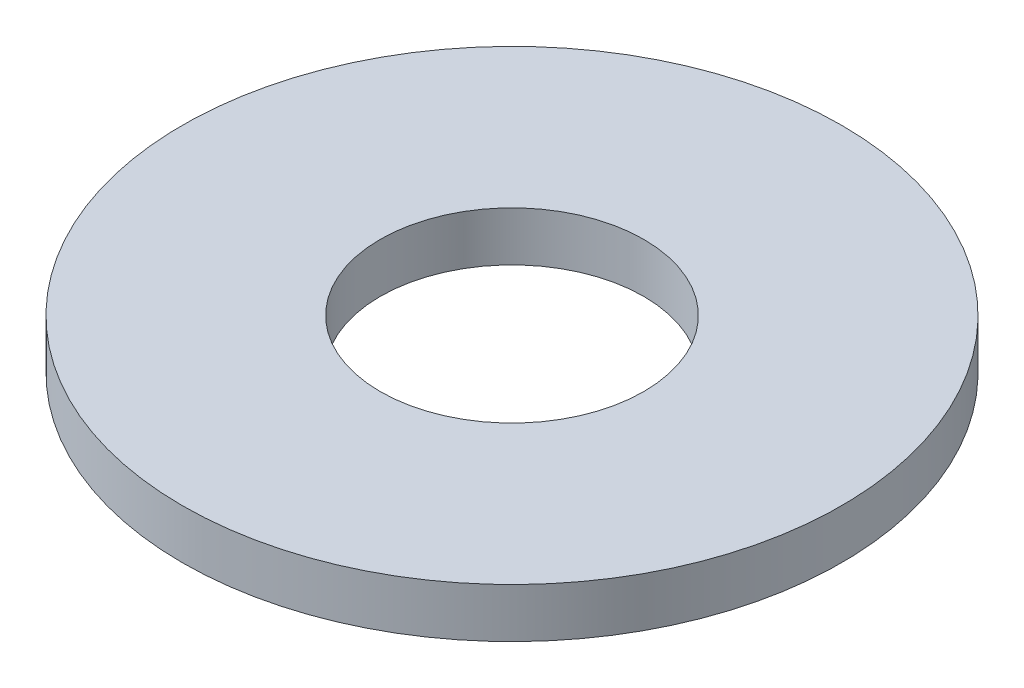
from build123d import *

# Parameters (mm, degrees)
SKETCH1_R           = 5
SKETCH1_R_2         = 2
BOSS_EXTRUDE1_DEPTH = 0.75


with BuildPart() as part:
    # Sketch1 → Boss-Extrude1 (new body)
    with BuildSketch(Plane(origin=(0, 0, 0), x_dir=(1, 0, 0), z_dir=(0, 1, 0))):
        with Locations(Location((0, 0, 0), (0, 0, 270))):
            Circle(SKETCH1_R)
        with Locations(Location((0, 0, 0), (0, 0, 270))):
            Circle(SKETCH1_R_2, mode=Mode.SUBTRACT)
    extrude(amount=BOSS_EXTRUDE1_DEPTH)


solid = part.part
